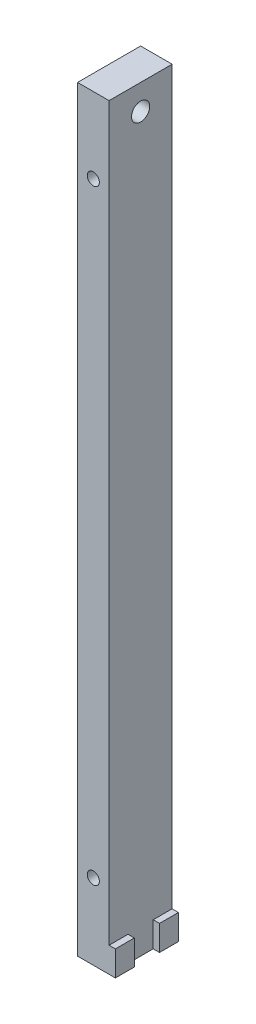
from build123d import *

# Parameters (mm, degrees)
BOSS_EXTRUDE1_DEPTH = 190.5
SKETCH2_W           = 1.5875
SKETCH2_H           = 15.875
CUT_EXTRUDE1_DEPTH  = 184.15
SKETCH3_R           = 1.524
CUT_EXTRUDE2_DEPTH  = 192.397469288
SKETCH4_R           = 2.286
CUT_EXTRUDE3_DEPTH  = 192.397469288


with BuildPart() as part:
    # Sketch1 → Boss-Extrude1 (new body)
    with BuildSketch(Plane(origin=(0, 0, 0), x_dir=(1, 0, 0), z_dir=(0, 1, 0))):
        Polygon((0, 0), (0, -15.875), (9.525, -15.875), (9.525, -11.1125), (7.9375, -11.1125), (7.9375, -4.7625), (9.525, -4.7625), (9.525, 0), align=None)
    extrude(amount=BOSS_EXTRUDE1_DEPTH)

    # Sketch2 → Cut-Extrude1 (cut)
    with BuildSketch(Plane(origin=(0, 190.5, 0), x_dir=(1, 0, 0), z_dir=(0, 1, 0))):
        with Locations((8.73125, -7.9375)):
            Rectangle(SKETCH2_W, SKETCH2_H)
    extrude(amount=-CUT_EXTRUDE1_DEPTH, mode=Mode.SUBTRACT)

    # Sketch3 → Cut-Extrude2 (cut, through all)
    with BuildSketch(Plane.XY.offset(15.875)):
        with Locations((3.96875, 19.05)):
            Circle(SKETCH3_R)
        with Locations((3.96875, 171.45)):
            Circle(SKETCH3_R)
    extrude(amount=-CUT_EXTRUDE2_DEPTH, mode=Mode.SUBTRACT)

    # Sketch4 → Cut-Extrude3 (cut, through all)
    with BuildSketch(Plane.ZY):
        with Locations((7.9375, 184.15)):
            Circle(SKETCH4_R)
    extrude(amount=-CUT_EXTRUDE3_DEPTH, mode=Mode.SUBTRACT)


solid = part.part
